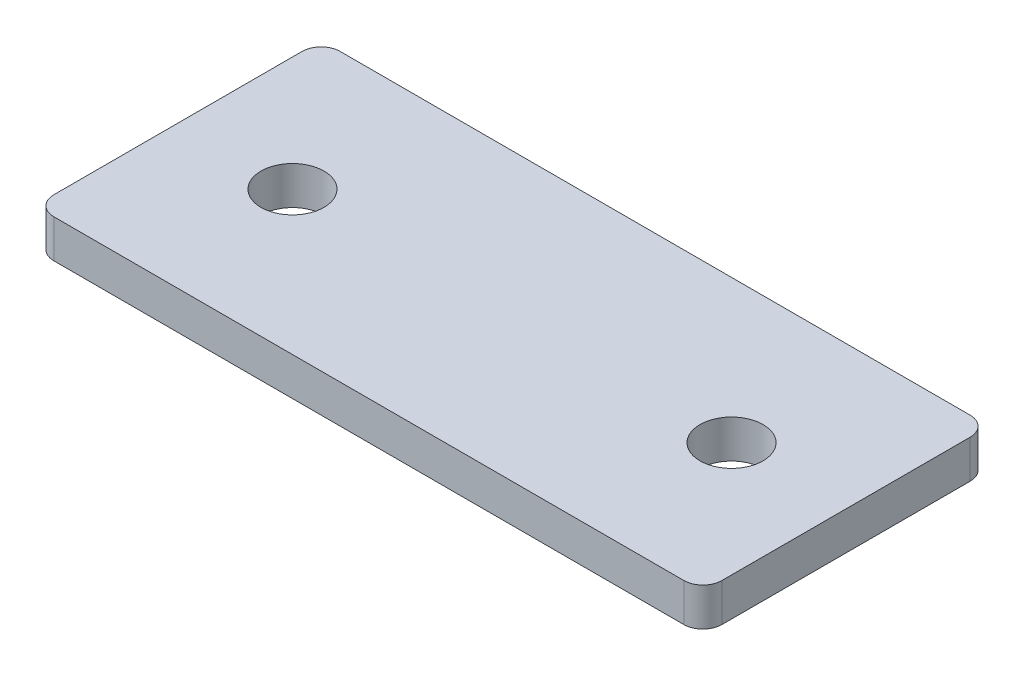
from build123d import *

# Parameters (mm, degrees)
SKETCH1_W                = 70
SKETCH1_H                = 30
BOSS_EXTRUDE1_DEPTH      = 4
FILLET1_R                = 2
M6_CLEARANCE_HOLE1_D     = 6.6
M6_CLEARANCE_HOLE1_DEPTH = 7
M6_CLEARANCE_HOLE1_TIP   = 1.982840043


with BuildPart() as part:
    # Sketch1 → Boss-Extrude1 (new body)
    with BuildSketch(Plane(origin=(0, 0, 0), x_dir=(1, 0, 0), z_dir=(0, 1, 0))):
        Rectangle(SKETCH1_W, SKETCH1_H)
    extrude(amount=BOSS_EXTRUDE1_DEPTH)

    # Fillet1
    fillet1_edges = [part.edges().sort_by_distance(p)[0] for p in [
        (-35, 2, -15),
        (35, 2, -15),
        (35, 2, 15),
        (-35, 2, 15),
    ]]
    fillet(fillet1_edges, radius=FILLET1_R)

    # M6 Clearance Hole1
    with Locations(Plane(origin=(0, 4, 0), x_dir=(1, 0, 0), z_dir=(0, 1, 0))):
        with Locations((-23, 0), (23, 0)):
            Hole(M6_CLEARANCE_HOLE1_D / 2, depth=M6_CLEARANCE_HOLE1_DEPTH)
            with Locations((0, 0, -(M6_CLEARANCE_HOLE1_DEPTH + M6_CLEARANCE_HOLE1_TIP / 2))):  # 118° drill point
                Cone(0, M6_CLEARANCE_HOLE1_D / 2, M6_CLEARANCE_HOLE1_TIP, mode=Mode.SUBTRACT)


solid = part.part
